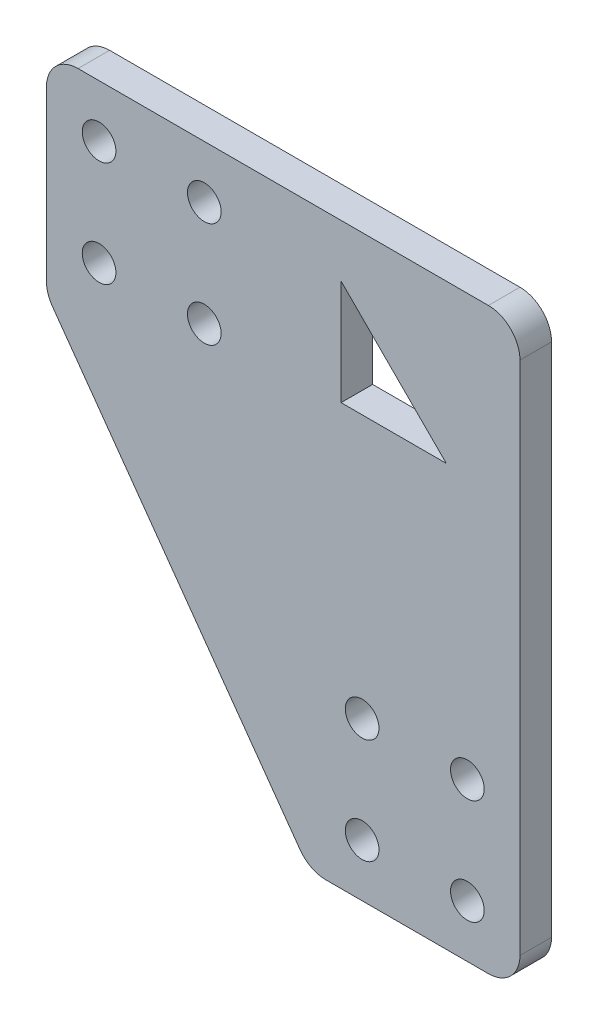
from build123d import *

# Parameters (mm, degrees)
SKETCH_1_R      = 1.6
EXTRUDE_1_DEPTH = 3
FILLET_1_R      = 3


with BuildPart() as part:
    # 草图1 → 凸台-拉伸1 (new body)
    with BuildSketch(Plane.XY):
        Polygon((0, 0), (45, 0), (45, -55), (25, -55), (0, -20), align=None)
        with Locations((5, -5)):
            Circle(SKETCH_1_R, mode=Mode.SUBTRACT)
        with Locations(Location((15, -5, 0), (0, 0, 180))):
            Circle(SKETCH_1_R, mode=Mode.SUBTRACT)
        with Locations((15, -15)):
            Circle(SKETCH_1_R, mode=Mode.SUBTRACT)
        with Locations(Location((5, -15, 0), (0, 0, 180))):
            Circle(SKETCH_1_R, mode=Mode.SUBTRACT)
        with Locations((30, -50)):
            Circle(SKETCH_1_R, mode=Mode.SUBTRACT)
        with Locations(Location((40, -50, 0), (0, 0, 180))):
            Circle(SKETCH_1_R, mode=Mode.SUBTRACT)
        with Locations((40, -40)):
            Circle(SKETCH_1_R, mode=Mode.SUBTRACT)
        with Locations(Location((30, -40, 0), (0, 0, 180))):
            Circle(SKETCH_1_R, mode=Mode.SUBTRACT)
        Polygon((28, -5), (28, -15), (38, -15), align=None, mode=Mode.SUBTRACT)
    extrude(amount=EXTRUDE_1_DEPTH)

    # 圆角1
    fillet_1_edges = [part.edges().sort_by_distance(p)[0] for p in [
        (0, 0, 1.5),
        (45, 0, 1.5),
        (45, -55, 1.5),
        (25, -55, 1.5),
        (0, -20, 1.5),
    ]]
    fillet(fillet_1_edges, radius=FILLET_1_R)


solid = part.part
